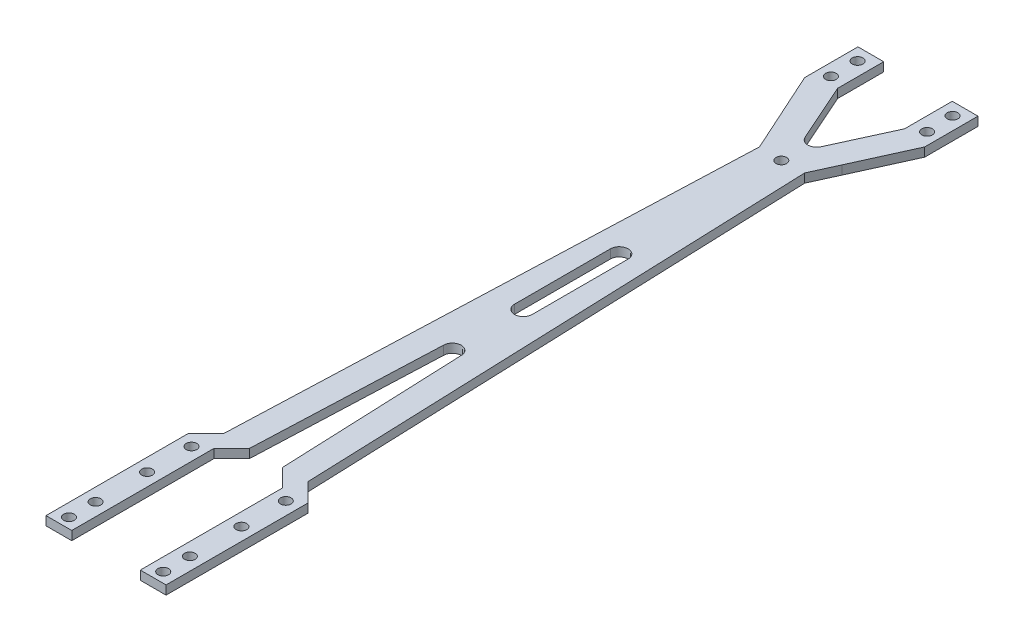
from build123d import *

# Parameters (mm, degrees)
SKETCH1_W           = 33.8
SKETCH1_H           = 228.6
BOSS_EXTRUDE1_DEPTH = 2.5
CUT_EXTRUDE1_DEPTH  = 2.5
SKETCH2_6_OUTSIDE_W = 82.02
SKETCH2_6_OUTSIDE_H = 276.82
CUT_EXTRUDE2_DEPTH  = 2.5
SKETCH5_R           = 1.5
CUT_EXTRUDE3_DEPTH  = 2.5


with BuildPart() as part:
    # Sketch1 → Boss-Extrude1 (new body)
    with BuildSketch(Plane(origin=(0, 0, 0), x_dir=(1, 0, 0), z_dir=(0, 1, 0))):
        with Locations((16.9, 114.3)):
            Rectangle(SKETCH1_W, SKETCH1_H)
    extrude(amount=BOSS_EXTRUDE1_DEPTH)

    # Sketch2 → Cut-Extrude1 (cut)
    with BuildSketch(Plane(origin=(0, 2.5, 0), x_dir=(1, 0, 0), z_dir=(0, 1, 0))):
        with BuildLine():
            Line((14.4, 144.5), (14.4, 117.5))
            add(Edge.make_bspline(
                [(14.4, 117.5), (14.399430285, 117.132237239), (14.536831695, 116.524171276), (14.991581605, 115.839645543), (15.586717627, 115.318158312), (16.441592425, 114.966926324), (17.439533495, 114.99714129), (18.330206262, 115.381489106), (19.143348717, 116.172968782), (19.401576387, 116.99766646), (19.4, 117.5)],
                knots=[0, 0, 0, 0, 0.141327045, 0.23205331, 0.31123598, 0.442337735, 0.576355834, 0.682960692, 0.808345553, 1, 1, 1, 1], degree=3))
            Line((19.4, 117.5), (19.4, 144.5))
            add(Edge.make_bspline(
                [(14.4, 144.5), (14.395253504, 145.223790204), (14.991433849, 146.512706872), (16.62609513, 147.107640812), (17.903590827, 146.872098871), (19.022537404, 146.103569848), (19.403497366, 145.098391499), (19.4, 144.5)],
                knots=[0, 0, 0, 0, 0.27696704, 0.498348678, 0.612918932, 0.769853345, 1, 1, 1, 1], degree=3))
        make_face()
    extrude(amount=-CUT_EXTRUDE1_DEPTH, mode=Mode.SUBTRACT)

    # Sketch2<6> outside → Cut-Extrude2 (cut)
    with BuildSketch(Plane(origin=(0, 2.5, 0), x_dir=(1, 0, 0), z_dir=(0, 1, 0))):
        with Locations((16.9, 114.3)):
            Rectangle(SKETCH2_6_OUTSIDE_W, SKETCH2_6_OUTSIDE_H)
        with BuildLine():
            Line((0, 228.6), (7.25, 228.6))
            Line((7.25, 228.6), (7.25, 215.6))
            Line((7.25, 215.6), (14.582490059, 199.162371251))
            add(Edge.make_bspline(
                [(14.582490059, 199.162371251), (14.711561898, 198.842062842), (15.023836131, 198.378588046), (15.614972661, 197.928802428), (16.251883656, 197.646972571), (17.023429753, 197.553241488), (17.859761798, 197.743006401), (18.671860535, 198.240651313), (19.070795177, 198.798035014), (19.217509941, 199.162371251)],
                knots=[0, 0, 0, 0, 0.175078363, 0.276949723, 0.373162948, 0.525807757, 0.662070379, 0.801161333, 1, 1, 1, 1], degree=3))
            Line((19.217509941, 199.162371251), (26.55, 215.173869546))
            Line((26.55, 215.173869546), (26.55, 228.6))
            Line((26.55, 228.6), (33.8, 228.6))
            Line((33.8, 228.6), (33.8, 213.6))
            Line((33.8, 213.6), (26.55, 197.6))
            Line((26.55, 197.6), (23.25, 190.35))
            Line((23.25, 190.35), (28.588836909, 45.211163091))
            Line((28.588836909, 45.211163091), (33.8, 40))
            Line((33.8, 40), (33.8, 0))
            Line((33.8, 0), (26.55, 0))
            Line((26.55, 0), (26.55, 40))
            Line((26.55, 40), (21.55, 45))
            Line((21.55, 45), (19.4, 97.5))
            add(Edge.make_bspline(
                [(14.4, 97.5), (14.39963006, 97.808675141), (14.484997073, 98.261085854), (14.753428782, 98.807348646), (15.054139544, 99.215057311), (15.586652418, 99.681982141), (16.380265598, 100.007326678), (17.208278255, 100.01514461), (17.857989388, 99.833449339), (18.395045275, 99.537224279), (18.85030775, 99.106523366), (19.272621439, 98.433524922), (19.400681372, 97.867995006), (19.4, 97.5)],
                knots=[0, 0, 0, 0, 0.118087348, 0.173138637, 0.232058356, 0.311090992, 0.441944339, 0.550747407, 0.622172143, 0.698428615, 0.783497697, 0.859367045, 1, 1, 1, 1], degree=3))
            Line((14.4, 97.5), (12.25, 45))
            Line((12.25, 45), (7.25, 40))
            Line((7.25, 40), (7.25, 0))
            Line((7.25, 0), (0, 0))
            Line((0, 0), (0, 40))
            Line((0, 40), (5, 45))
            Line((5, 45), (10.53515625, 190.35))
            Line((10.53515625, 190.35), (7.23515625, 197.632758621))
            Line((7.23515625, 197.632758621), (0, 213.6))
            Line((0, 213.6), (0, 228.6))
        make_face(mode=Mode.SUBTRACT)
    extrude(amount=-CUT_EXTRUDE2_DEPTH, mode=Mode.SUBTRACT)

    # Sketch5 → Cut-Extrude3 (cut)
    with BuildSketch(Plane(origin=(0, 2.5, 0), x_dir=(1, 0, 0), z_dir=(0, 1, 0))):
        with Locations((3.398371539, 225.1)):
            Circle(SKETCH5_R)
        with Locations((3.398371539, 217.6)):
            Circle(SKETCH5_R)
        with Locations((30.132823035, 225.1)):
            Circle(SKETCH5_R)
        with Locations((30.468201459, 217.6)):
            Circle(SKETCH5_R)
        with Locations((3.625, 2.833121102)):
            Circle(SKETCH5_R)
        with Locations((30.175, 2.833121102)):
            Circle(SKETCH5_R)
        with Locations((3.625, 10.333121102)):
            Circle(SKETCH5_R)
        with Locations((3.625, 24.833121102)):
            Circle(SKETCH5_R)
        with Locations((3.625, 37.333121102)):
            Circle(SKETCH5_R)
        with Locations((30.175, 10.333121102)):
            Circle(SKETCH5_R)
        with Locations((30.175, 24.833121102)):
            Circle(SKETCH5_R)
        with Locations((30.175, 37.333121102)):
            Circle(SKETCH5_R)
        with Locations((16.926550078, 190.1)):
            Circle(SKETCH5_R)
    extrude(amount=-CUT_EXTRUDE3_DEPTH, mode=Mode.SUBTRACT)


solid = part.part
